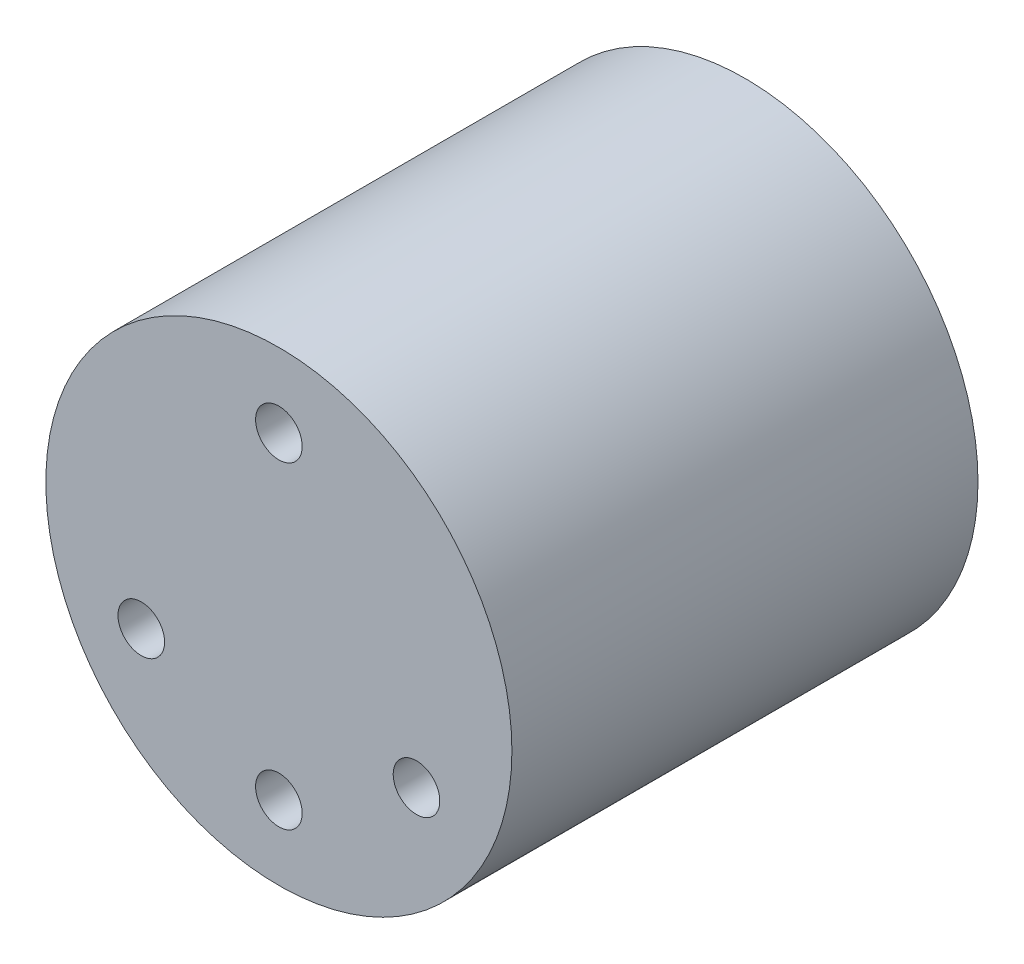
from build123d import *

# Parameters (mm, degrees)
SKETCH_1_R      = 11
SKETCH_1_R_2    = 1.1
EXTRUDE_1_DEPTH = 22


with BuildPart() as part:
    # 草图1 → 凸台-拉伸1 (new body)
    with BuildSketch(Plane.XY):
        Circle(SKETCH_1_R)
        with Locations((0, 7.5)):
            Circle(SKETCH_1_R_2, mode=Mode.SUBTRACT)
        with Locations((0, -7.5)):
            Circle(SKETCH_1_R_2, mode=Mode.SUBTRACT)
        with Locations((-6.495190528, -3.75)):
            Circle(SKETCH_1_R_2, mode=Mode.SUBTRACT)
        with Locations(Location((6.495190528, -3.75, 0), (0, 0, 180))):
            Circle(SKETCH_1_R_2, mode=Mode.SUBTRACT)
    extrude(amount=EXTRUDE_1_DEPTH)


solid = part.part
